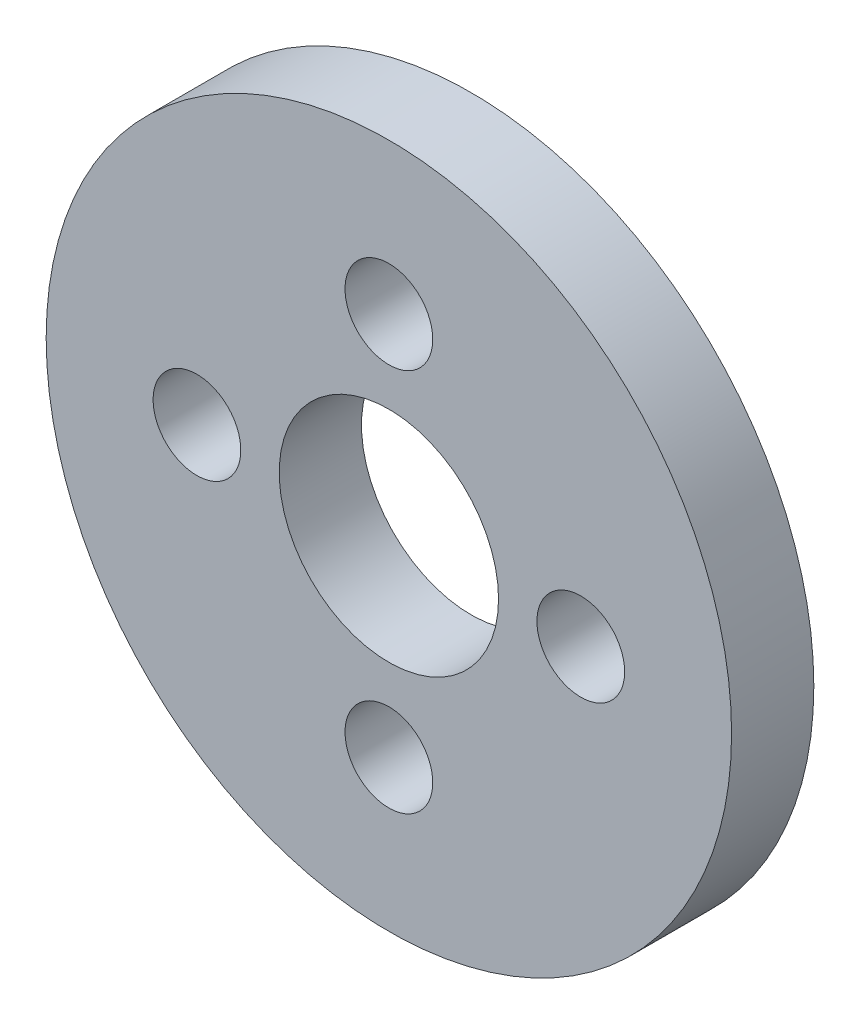
from build123d import *

# Parameters (mm, degrees)
SKETCH_1_R      = 12.5
SKETCH_1_R_2    = 4
SKETCH_1_R_3    = 1.6
EXTRUDE_1_DEPTH = 3


with BuildPart() as part:
    # 草图1 → 凸台-拉伸1 (new body)
    with BuildSketch(Plane.XY):
        Circle(SKETCH_1_R)
        Circle(SKETCH_1_R_2, mode=Mode.SUBTRACT)
        with Locations((0, 7)):
            Circle(SKETCH_1_R_3, mode=Mode.SUBTRACT)
        with Locations((7, 0)):
            Circle(SKETCH_1_R_3, mode=Mode.SUBTRACT)
        with Locations(Location((-7, 0, 0), (0, 0, 180))):
            Circle(SKETCH_1_R_3, mode=Mode.SUBTRACT)
        with Locations(Location((0, -7, 0), (0, 0, 180))):
            Circle(SKETCH_1_R_3, mode=Mode.SUBTRACT)
    extrude(amount=EXTRUDE_1_DEPTH)


solid = part.part
